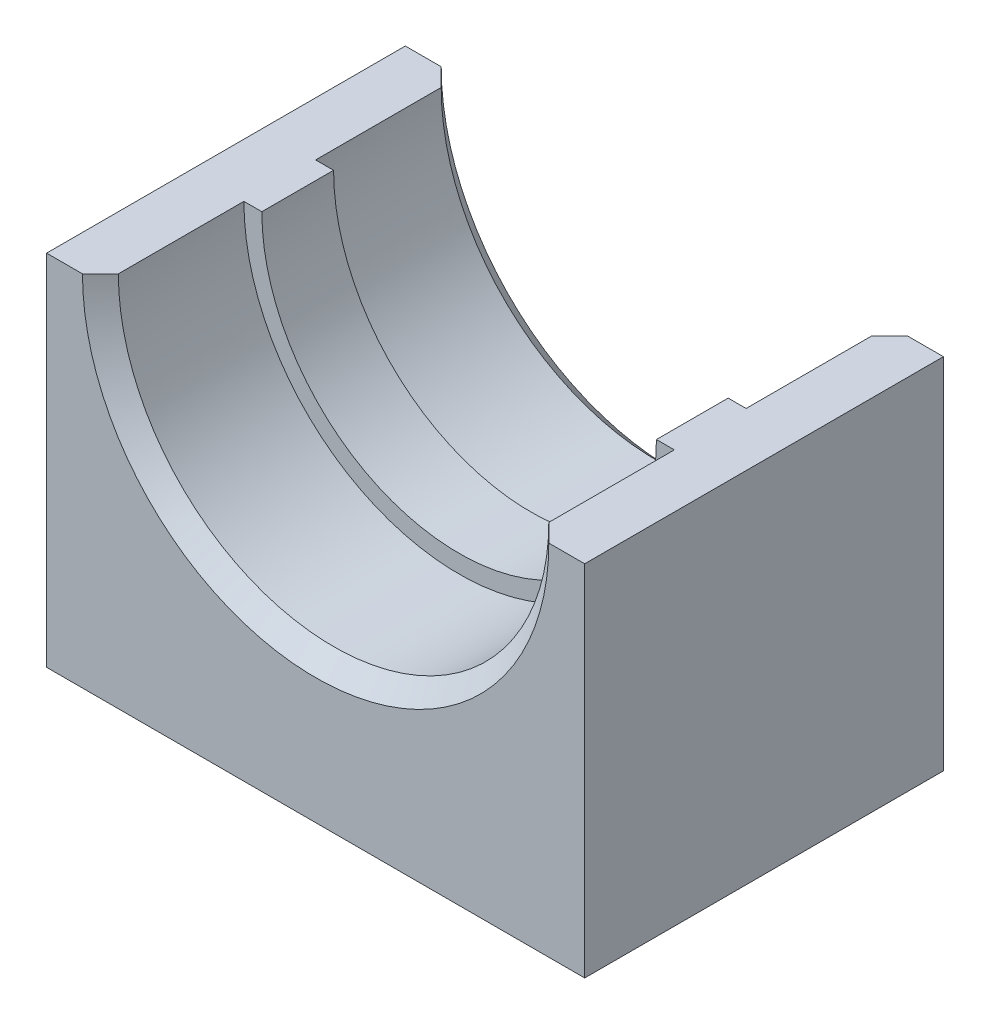
from build123d import *

# Parameters (mm, degrees)
SKETCH_1_W          = 30
SKETCH_1_H          = 20
EXTRUDE_1_DEPTH     = 10
SKETCH_2_R          = 12
CUT_EXTRUDE_1_DEPTH = 8
SKETCH_3_R          = 11
CUT_EXTRUDE_2_DEPTH = 10
CHAMFER_1_SIZE      = 1


with BuildPart() as part:
    # 스케치1 → 보스-돌출1 (new, symmetric)
    with BuildSketch(Plane.XY):
        Rectangle(SKETCH_1_W, SKETCH_1_H)
    extrude(amount=EXTRUDE_1_DEPTH, both=True)

    # 스케치2 → 컷-돌출1 (cut)
    with BuildSketch(Plane.XY.offset(10)):
        with Locations((0, 10)):
            Circle(SKETCH_2_R)
    cut_extrude_1 = extrude(amount=-CUT_EXTRUDE_1_DEPTH, mode=Mode.SUBTRACT)

    # 대칭 복사1: 컷-돌출1 across plane
    add(cut_extrude_1.mirror(Plane.XY), mode=Mode.SUBTRACT)

    # 스케치3 → 컷-돌출2 (cut)
    with BuildSketch(Plane.XY.offset(2)):
        with Locations((0, 10)):
            Circle(SKETCH_3_R)
    extrude(amount=-CUT_EXTRUDE_2_DEPTH, mode=Mode.SUBTRACT)

    # 모따기1
    chamfer_1_edges = [part.edges().sort_by_distance(p)[0] for p in [
        (0, -2, 10),
        (0, -2, -10),
    ]]
    chamfer(chamfer_1_edges, length=CHAMFER_1_SIZE)


solid = part.part
